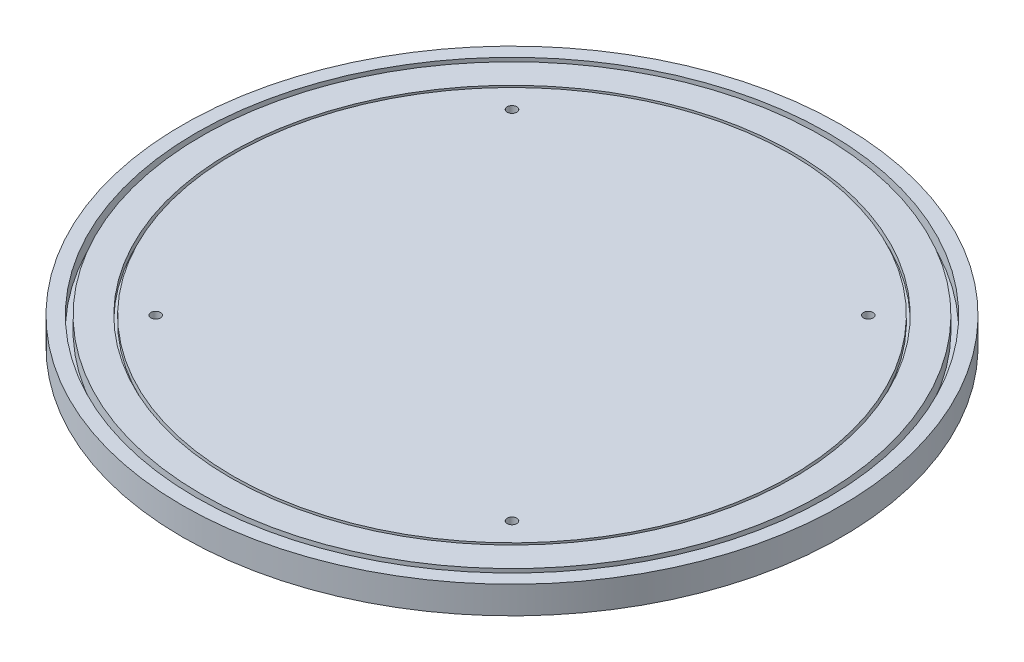
from build123d import *

# Parameters (mm, degrees)
ESQUISSE5_R             = 1.75
ENL_V_MAT_EXTRU_3_DEPTH = 10


with BuildPart() as part:
    # Esquisse1 → Révolution1 (revolve)
    with BuildSketch(Plane(origin=(0, 0, 0), x_dir=(0, 0, -1), z_dir=(1, 0, 0)), mode=Mode.PRIVATE) as r_volution1_sk:
        Polygon((101.754375518, 10), (101.754375518, 7.872703136), (102.754375518, 7.872703136), (102.754375518, 10), (113.254375518, 10), (113.254375518, 5), (115.25030387, 5), (115.25030387, 10), (120.254297163, 10), (120.254297163, 0), (0.004375518, 0), (0.004375518, 10), align=None)
    revolve(r_volution1_sk.sketch.rotate(Axis((0, 10, -0.004375518), (0, -1, 0)), 180), axis=Axis((0, 10, -0.004375518), (0, -1, 0)))

    # Esquisse5 → Enlèv. mat.-Extru.3 (cut)
    with BuildSketch(Plane.XZ):
        with Locations(Location((-65, 65, 0), (0, 0, 270))):
            Circle(ESQUISSE5_R)
        with Locations(Location((-65, -65, 0), (0, 0, 270))):
            Circle(ESQUISSE5_R)
        with Locations(Location((65, 65, 0), (0, 0, 270))):
            Circle(ESQUISSE5_R)
        with Locations(Location((65, -65, 0), (0, 0, 270))):
            Circle(ESQUISSE5_R)
    extrude(amount=-ENL_V_MAT_EXTRU_3_DEPTH, mode=Mode.SUBTRACT)


solid = part.part
